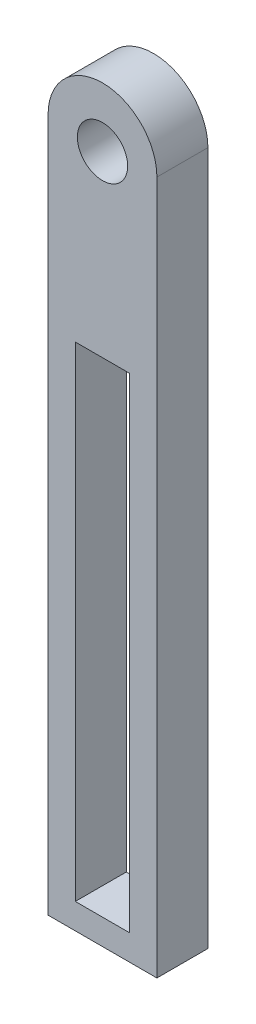
from build123d import *

# Parameters (mm, degrees)
SKETCH2_R           = 4.699
SKETCH2_W           = 10.16
SKETCH2_H           = 90.4875
BOSS_EXTRUDE1_DEPTH = 9.525


with BuildPart() as part:
    # Sketch2 → Boss-Extrude1 (new body)
    with BuildSketch(Plane.XY):
        with BuildLine():
            Line((-22.220156591, -20.454196066), (-22.220156591, -149.994196066))
            Line((-22.220156591, -149.994196066), (-1.900156591, -149.994196066))
            Line((-1.900156591, -149.994196066), (-1.900156591, -20.454196066))
            ThreePointArc((-1.900156591, -20.454196066), (-12.060156591, -10.294196066), (-22.220156591, -20.454196066))
        make_face()
        with Locations(Location((-12.060156591, -21.406696066, 0), (0, 0, 180))):
            Circle(SKETCH2_R, mode=Mode.SUBTRACT)
        with Locations((-12.060156591, -99.987946066)):
            Rectangle(SKETCH2_W, SKETCH2_H, mode=Mode.SUBTRACT)
    extrude(amount=BOSS_EXTRUDE1_DEPTH)


solid = part.part
